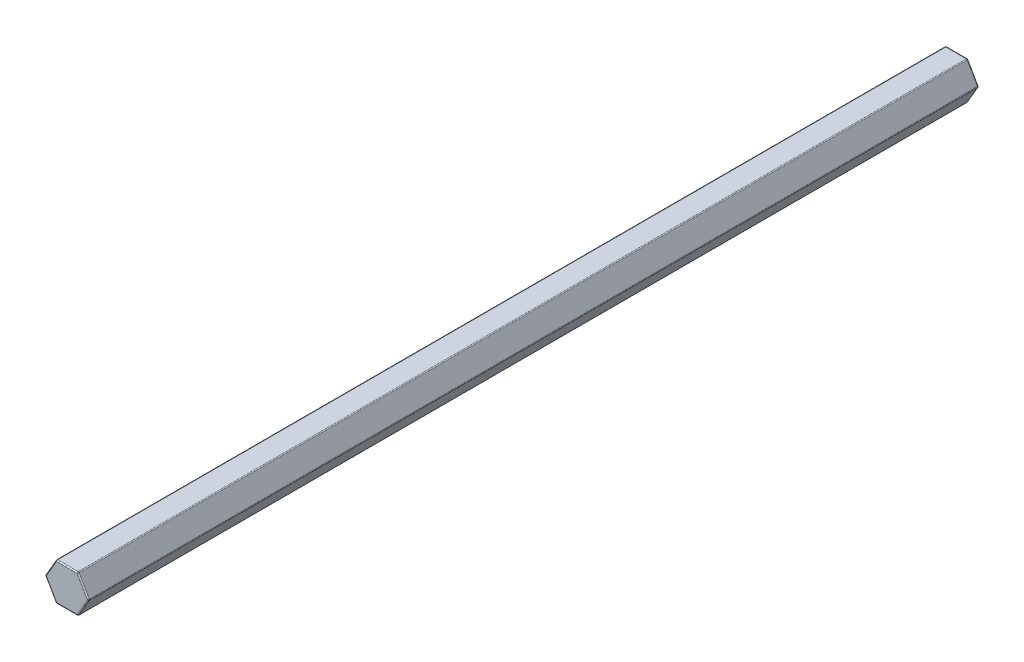
from build123d import *

# Parameters (mm, degrees)
BOSS_EXTRUDE1_DEPTH = 75
FILLET1_R           = 0.2


with BuildPart() as part:
    # Sketch1 → Boss-Extrude1 (new, symmetric)
    with BuildSketch(Plane.XY):
        Polygon((3.666174209, 0), (1.833087105, 3.175), (-1.833087105, 3.175), (-3.666174209, 0), (-1.833087105, -3.175), (1.833087105, -3.175), align=None)
    extrude(amount=BOSS_EXTRUDE1_DEPTH, both=True)

    # Fillet1
    fillet1_edges = [part.edges().sort_by_distance(p)[0] for p in [
        (2.749630657, 1.5875, -75),
        (-2.749630657, 1.5875, -75),
        (0, -3.175, -75),
        (-3.666174209, 0, 0),
        (-1.833087105, -3.175, 0),
        (-2.749630657, -1.5875, -75),
        (1.833087105, -3.175, 0),
        (3.666174209, 0, 0),
        (2.749630657, -1.5875, -75),
        (1.833087105, 3.175, 0),
        (-1.833087105, 3.175, 0),
        (0, 3.175, -75),
        (0, -3.175, 75),
        (-2.749630657, -1.5875, 75),
        (-2.749630657, 1.5875, 75),
        (0, 3.175, 75),
        (2.749630657, 1.5875, 75),
        (2.749630657, -1.5875, 75),
    ]]
    fillet(fillet1_edges, radius=FILLET1_R)


solid = part.part
